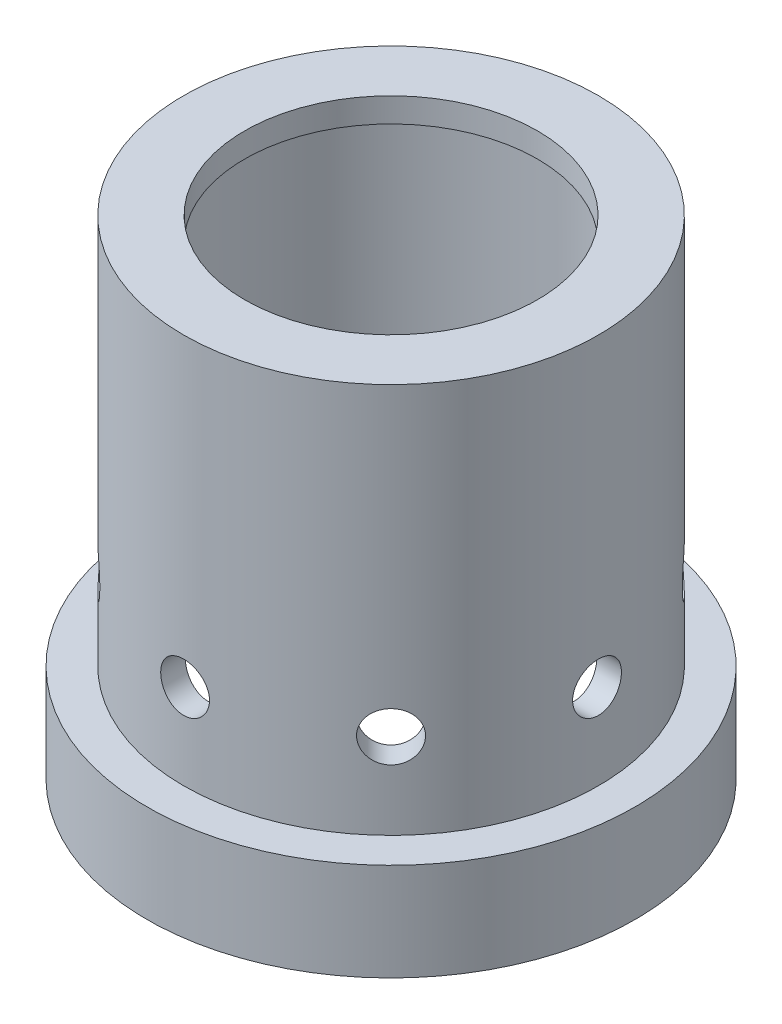
from build123d import *

# Parameters (mm, degrees)
SHELL3_T           = -2.54
SKETCH2_R          = 15.24
CUT_EXTRUDE2_DEPTH = 63.217039467
SKETCH3_R          = 2.54
CUT_EXTRUDE3_DEPTH = 63.217039467
CIRPATTERN1_COUNT  = 8


with BuildPart() as part:
    # Sketch1 → Revolve1 (revolve)
    with BuildSketch(Plane.XY, mode=Mode.PRIVATE) as revolve1_sk:
        Polygon((0, 0), (0, 50.8), (21.59, 50.8), (21.59, 10.16), (25.4, 10.16), (25.4, 0), align=None)
    revolve(revolve1_sk.sketch.rotate(Axis((0, 0, 0), (0, 1, 0)), 90), axis=Axis((0, 0, 0), (0, 1, 0)))

    # Shell3
    shell3_openings = [part.faces().sort_by_distance(p)[0] for p in [
        (0, 0, 0),
    ]]
    offset(amount=SHELL3_T, openings=shell3_openings, kind=Kind.INTERSECTION)

    # Sketch2 → Cut-Extrude2 (cut, through all)
    with BuildSketch(Plane(origin=(0, 50.8, 0), x_dir=(1, 0, 0), z_dir=(0, 1, 0))):
        with Locations(Location((0, 0, 0), (0, 0, 270))):
            Circle(SKETCH2_R)
    extrude(amount=-CUT_EXTRUDE2_DEPTH, mode=Mode.SUBTRACT)

    # Sketch3 → Cut-Extrude3 (cut, through all)
    with BuildSketch(Plane.XY):
        with Locations(Location((0, 19.05, 0), (0, 0, 90))):
            Circle(SKETCH3_R)
    cut_extrude3 = extrude(amount=-CUT_EXTRUDE3_DEPTH, mode=Mode.SUBTRACT)

    # CirPattern1: Cut-Extrude3 ×8 about axis
    cirpattern1_axis = Axis((0, 50.8, 0), (0, -1, 0))
    for i in range(1, CIRPATTERN1_COUNT):
        add(cut_extrude3.rotate(cirpattern1_axis, i * 360 / CIRPATTERN1_COUNT), mode=Mode.SUBTRACT)


solid = part.part
